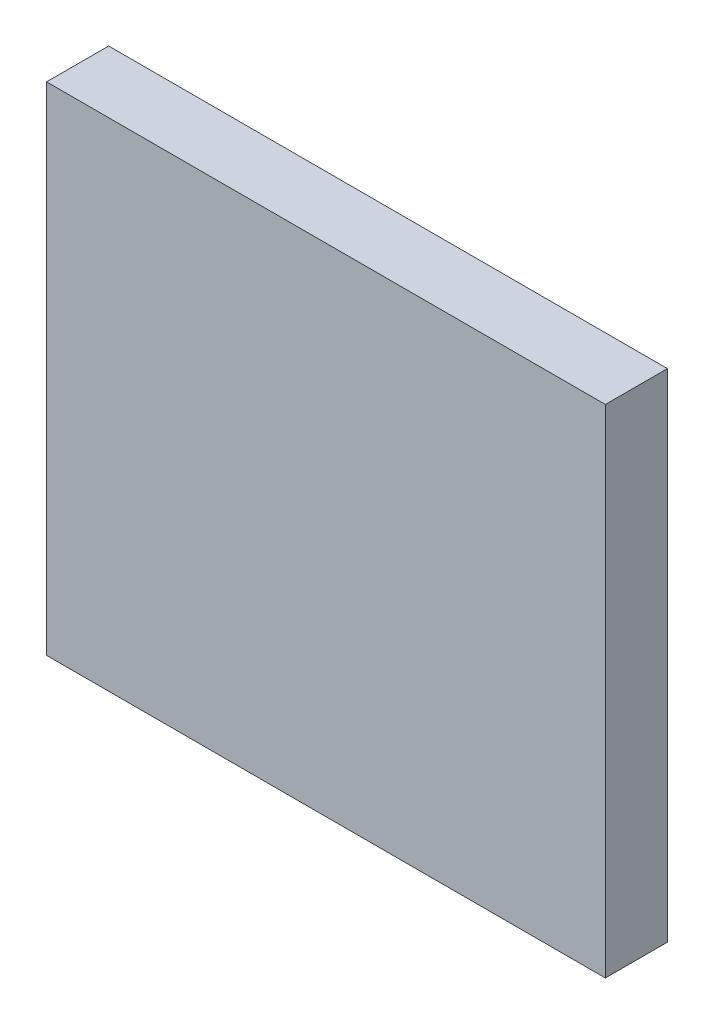
from build123d import *

# Parameters (mm, degrees)
ESQUISSE1_W        = 90
ESQUISSE1_H        = 80
BOSS_EXTRU_1_DEPTH = 10


with BuildPart() as part:
    # Esquisse1 → Boss.-Extru.1 (new body)
    with BuildSketch(Plane.XY):
        with Locations((45, 40)):
            Rectangle(ESQUISSE1_W, ESQUISSE1_H)
    extrude(amount=BOSS_EXTRU_1_DEPTH)


solid = part.part
